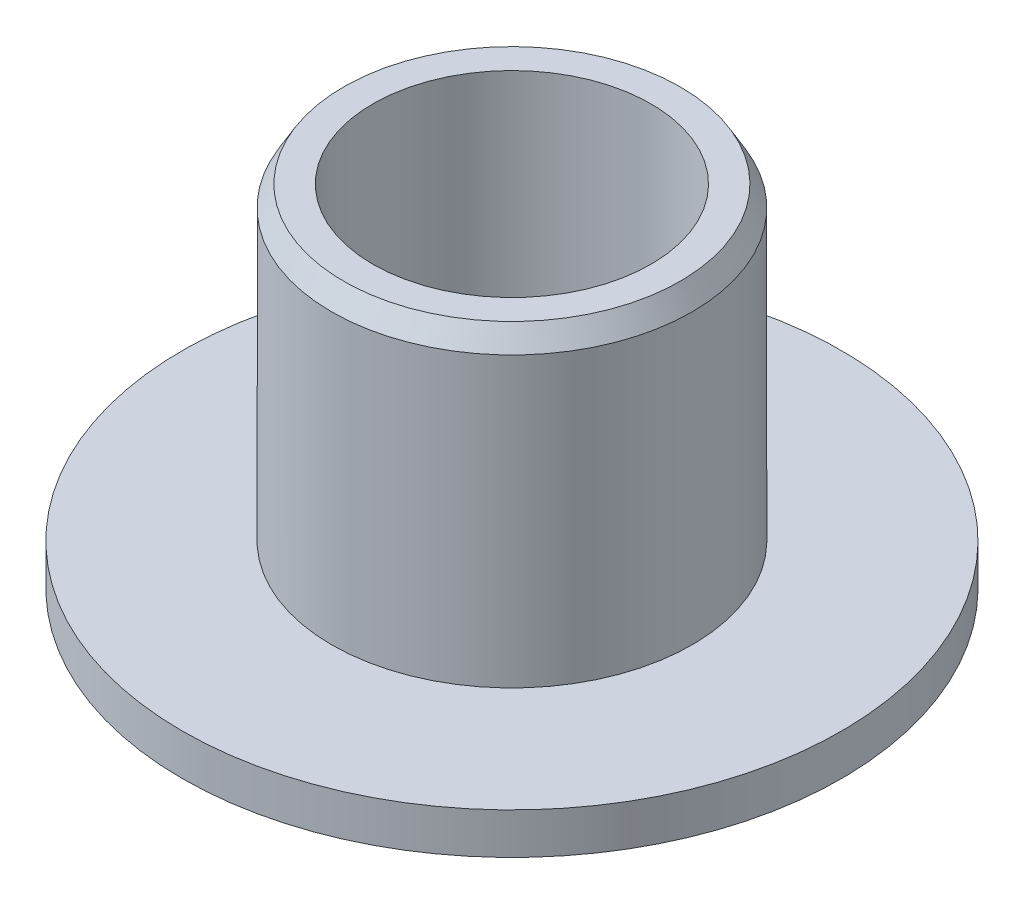
from build123d import *

# Parameters (mm, degrees)
CHAMFER1_SIZE  = 1
CHAMFER1_SIZE2 = 0.577350269


with BuildPart() as part:
    # Sketch1 → Revolve1 (revolve)
    with BuildSketch(Plane.XY, mode=Mode.PRIVATE) as revolve1_sk:
        Polygon((16, 2), (9, 2), (8.75, 2), (8.75, 17), (6.75, 17), (6.75, 6.533333333), (2.5, 2), (0, 2), (0, 0), (16, 0), align=None)
        Polygon((6.75, 2), (6.75, 5.466666667), (3.5, 2), align=None, mode=Mode.SUBTRACT)
    revolve(revolve1_sk.sketch.rotate(Axis((0, 21.623043933, 0), (0, -1, 0)), 90), axis=Axis((0, 21.623043933, 0), (0, -1, 0)))

    # Chamfer1
    chamfer1_edges = [part.edges().sort_by_distance(p)[0] for p in [
        (0, 17, -8.75),
    ]]
    chamfer1_side = [part.faces().sort_by_distance(p)[0] for p in [
        (0, 9.5, -8.75),
    ]]
    chamfer(chamfer1_edges, length=CHAMFER1_SIZE, length2=CHAMFER1_SIZE2, reference=chamfer1_side[0])


solid = part.part
